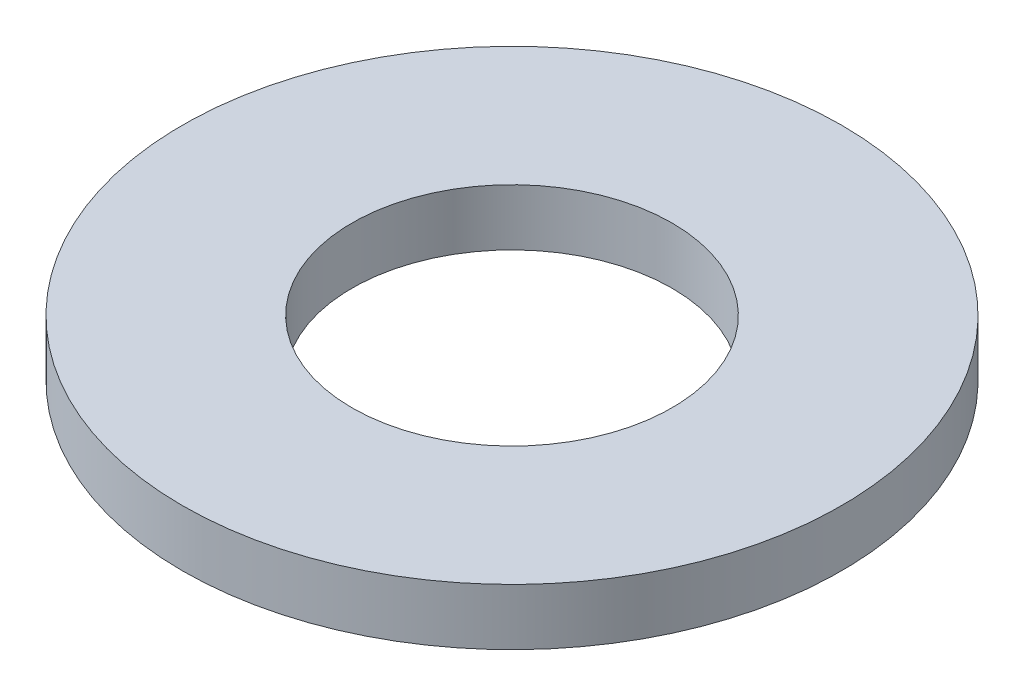
from build123d import *

# Parameters (mm, degrees)
SKETCH1_W = 0.9
SKETCH1_H = 0.3


with BuildPart() as part:
    # Sketch1 → Revolve1 (revolve)
    with BuildSketch(Plane.XY, mode=Mode.PRIVATE) as revolve1_sk:
        with Locations((1.3, 0.15)):
            Rectangle(SKETCH1_W, SKETCH1_H)
    revolve(revolve1_sk.sketch.rotate(Axis((0, 1.67737833, 0), (0, -1, 0)), 90), axis=Axis((0, 1.67737833, 0), (0, -1, 0)))


solid = part.part
